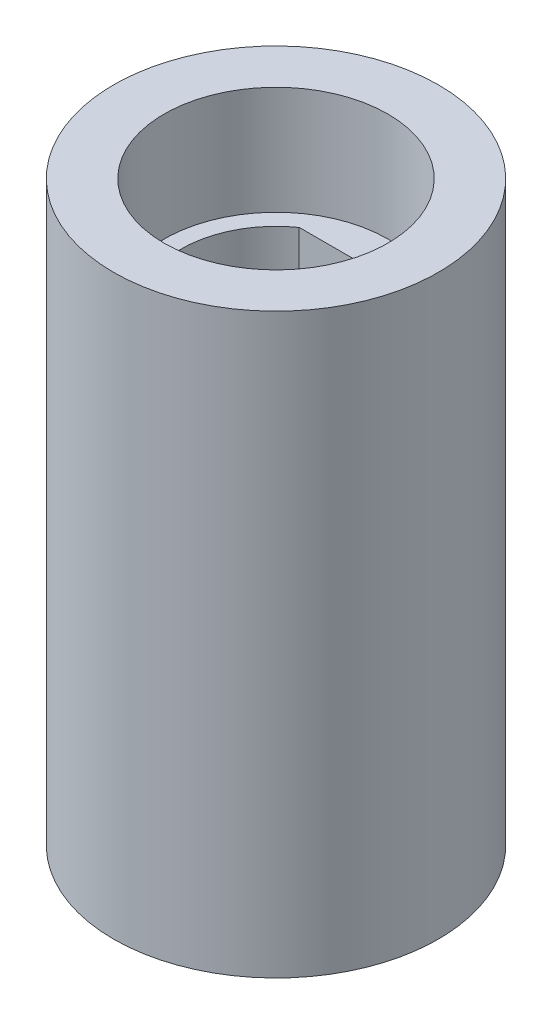
from build123d import *

# Parameters (mm, degrees)
SKETCH1_R           = 4.5
BOSS_EXTRUDE1_DEPTH = 16
SKETCH2_R           = 3.1
CUT_EXTRUDE1_DEPTH  = 3


with BuildPart() as part:
    # Sketch1 → Boss-Extrude1 (new body)
    with BuildSketch(Plane(origin=(0, 0, 0), x_dir=(1, 0, 0), z_dir=(0, 1, 0))):
        with Locations(Location((0, 0, 0), (0, 0, 270))):
            Circle(SKETCH1_R)
        with BuildLine():
            Line((1.506029548, 2.15), (-1.506029548, 2.15))
            ThreePointArc((-1.506029548, 2.15), (0, -2.625), (1.506029548, 2.15))
        make_face(mode=Mode.SUBTRACT)
    extrude(amount=BOSS_EXTRUDE1_DEPTH)

    # Sketch2 → Cut-Extrude1 (cut)
    with BuildSketch(Plane(origin=(0, 16, 0), x_dir=(1, 0, 0), z_dir=(0, 1, 0))):
        with Locations(Location((0, 0, 0), (0, 0, 270))):
            Circle(SKETCH2_R)
    extrude(amount=-CUT_EXTRUDE1_DEPTH, mode=Mode.SUBTRACT)


solid = part.part
